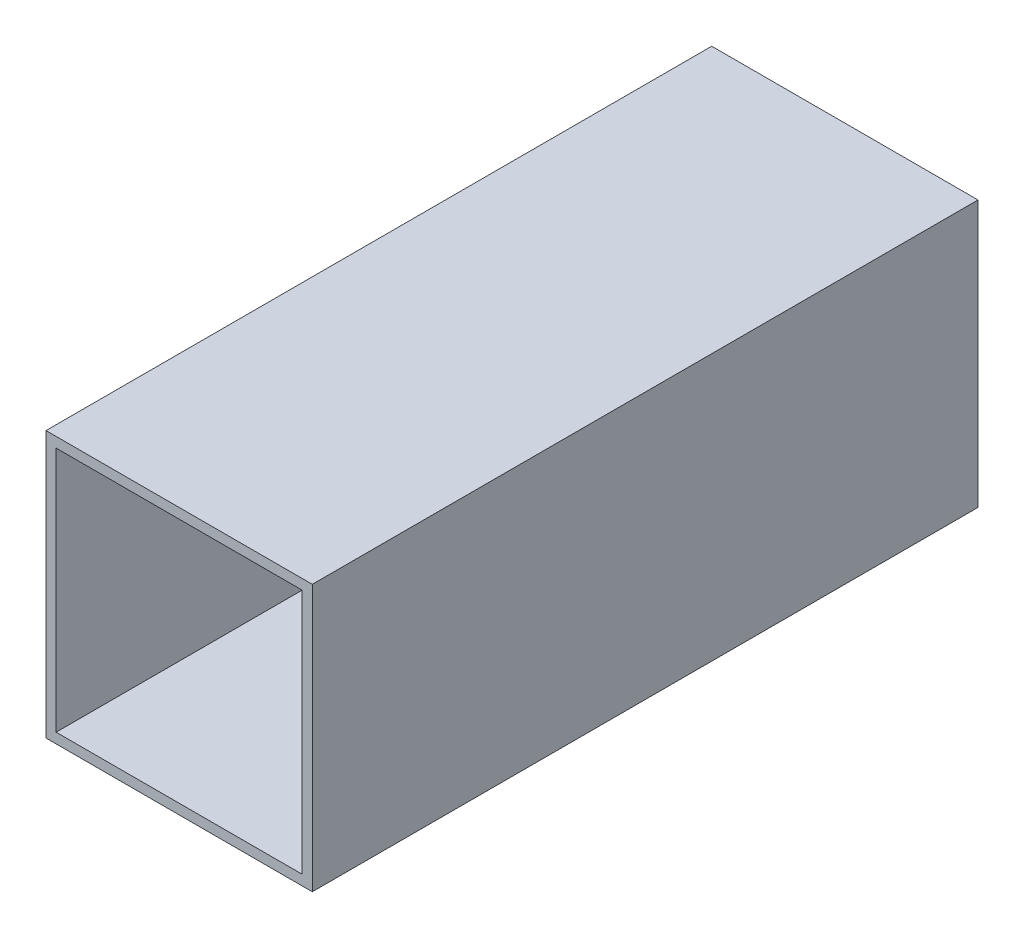
from build123d import *

# Parameters (mm, degrees)
CROQUIS1_W              = 76.2
CROQUIS1_H              = 76.2
CROQUIS1_W_2            = 70.4
CROQUIS1_H_2            = 70.4
SALIENTE_EXTRUIR1_DEPTH = 190.5


with BuildPart() as part:
    # Croquis1 → Saliente-Extruir1 (new body)
    with BuildSketch(Plane.XY):
        with Locations((38.1, -38.1)):
            Rectangle(CROQUIS1_W, CROQUIS1_H)
        with Locations((38.1, -38.1)):
            Rectangle(CROQUIS1_W_2, CROQUIS1_H_2, mode=Mode.SUBTRACT)
    extrude(amount=SALIENTE_EXTRUIR1_DEPTH)


solid = part.part
